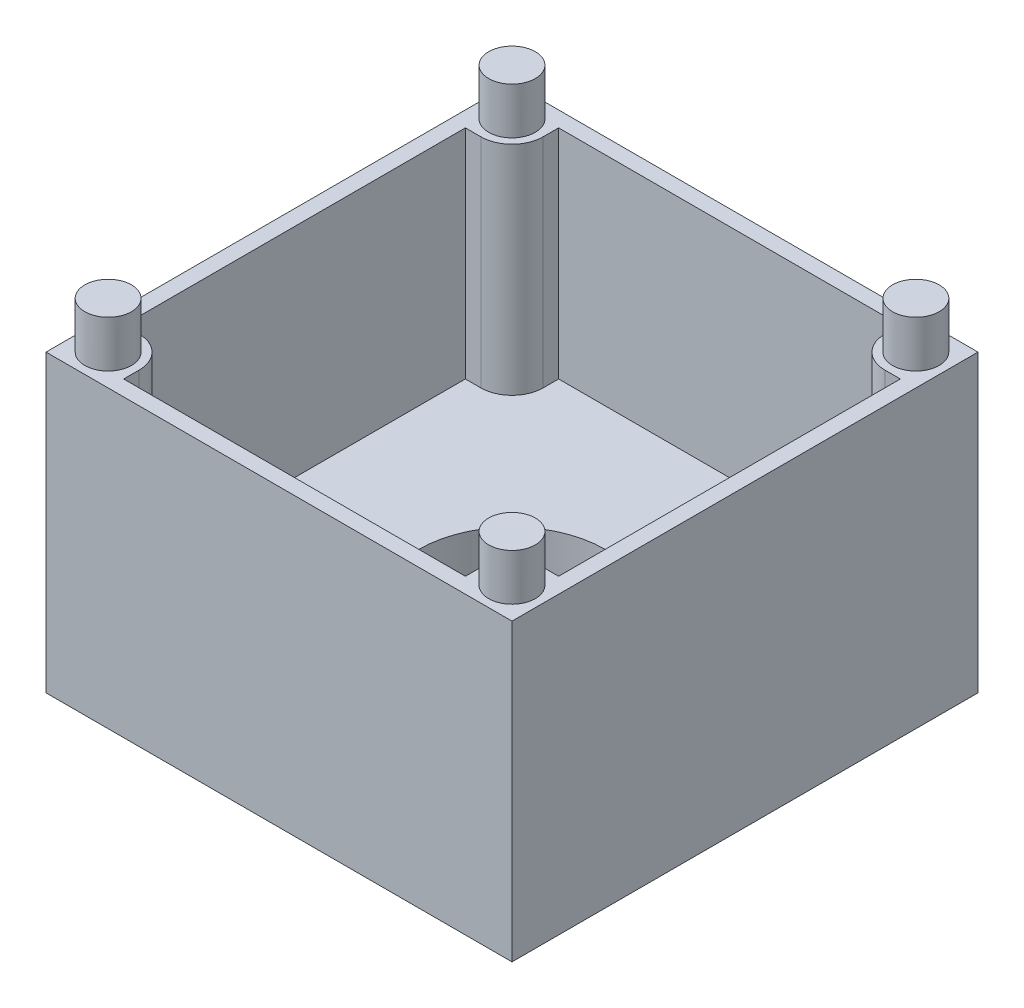
from build123d import *

# Parameters (mm, degrees)
SKETCH_1_W          = 15
SKETCH_1_H          = 15
EXTRUDE_1_DEPTH     = 9.5
CUT_EXTRUDE_1_DEPTH = 7
SKETCH_5_R          = 0.75
EXTRUDE_2_DEPTH     = 1.5
CUT_EXTRUDE_2_REACH = 17.281
SKETCH_6_R          = 3


with BuildPart() as part:
    # 草图1 → 凸台-拉伸1 (new body)
    with BuildSketch(Plane(origin=(0, 0, 0), x_dir=(1, 0, 0), z_dir=(0, 1, 0))):
        Rectangle(SKETCH_1_W, SKETCH_1_H)
    extrude(amount=EXTRUDE_1_DEPTH)

    # 草图2 → 切除-拉伸1 (cut)
    with BuildSketch(Plane(origin=(0, 9.5, 0), x_dir=(-1, 0, 0), z_dir=(0, 1, 0))):
        with BuildLine():
            Line((6.5, -5.5), (7, -5.5))
            Line((7, -5.5), (7, 5.5))
            Line((7, 5.5), (6.5, 5.5))
            ThreePointArc((6.5, 5.5), (5.792893219, 5.792893219), (5.5, 6.5))
            Line((5.5, 6.5), (5.5, 7))
            Line((5.5, 7), (-5.5, 7))
            Line((-5.5, 7), (-5.5, 6.5))
            ThreePointArc((-5.5, 6.5), (-5.792893219, 5.792893219), (-6.5, 5.5))
            Line((-6.5, 5.5), (-7, 5.5))
            Line((-7, 5.5), (-7, -5.5))
            Line((-7, -5.5), (-6.5, -5.5))
            ThreePointArc((-6.5, -5.5), (-5.792893219, -5.792893219), (-5.5, -6.5))
            Line((-5.5, -6.5), (-5.5, -7))
            Line((-5.5, -7), (5.5, -7))
            Line((5.5, -7), (5.5, -6.5))
            ThreePointArc((5.5, -6.5), (5.792893219, -5.792893219), (6.5, -5.5))
        make_face()
    extrude(amount=-CUT_EXTRUDE_1_DEPTH, mode=Mode.SUBTRACT)

    # 草图5 → 凸台-拉伸2 (add)
    with BuildSketch(Plane(origin=(0, 9.5, 0), x_dir=(-1, 0, 0), z_dir=(0, 1, 0))):
        with Locations(Location((6.5, -6.5, 0), (0, 0, 270))):
            Circle(SKETCH_5_R)
        with Locations(Location((6.5, 6.5, 0), (0, 0, 270))):
            Circle(SKETCH_5_R)
        with Locations(Location((-6.5, 6.5, 0), (0, 0, 270))):
            Circle(SKETCH_5_R)
        with Locations(Location((-6.5, -6.5, 0), (0, 0, 270))):
            Circle(SKETCH_5_R)
    extrude(amount=EXTRUDE_2_DEPTH)

    # 草图6 → 切除-拉伸2 (cut, up to next)
    with BuildSketch(Plane.XZ, mode=Mode.PRIVATE) as cut_extrude_2_sk1:
        with Locations(Location((0, 0, 0), (0, 0, 270))):
            Circle(SKETCH_6_R)
    cut_extrude_2_tool1 = extrude(cut_extrude_2_sk1.sketch, amount=-CUT_EXTRUDE_2_REACH, mode=Mode.PRIVATE) & part.part
    add(cut_extrude_2_tool1.solids().sort_by_distance((0, 0, 0))[0], mode=Mode.SUBTRACT)


solid = part.part
